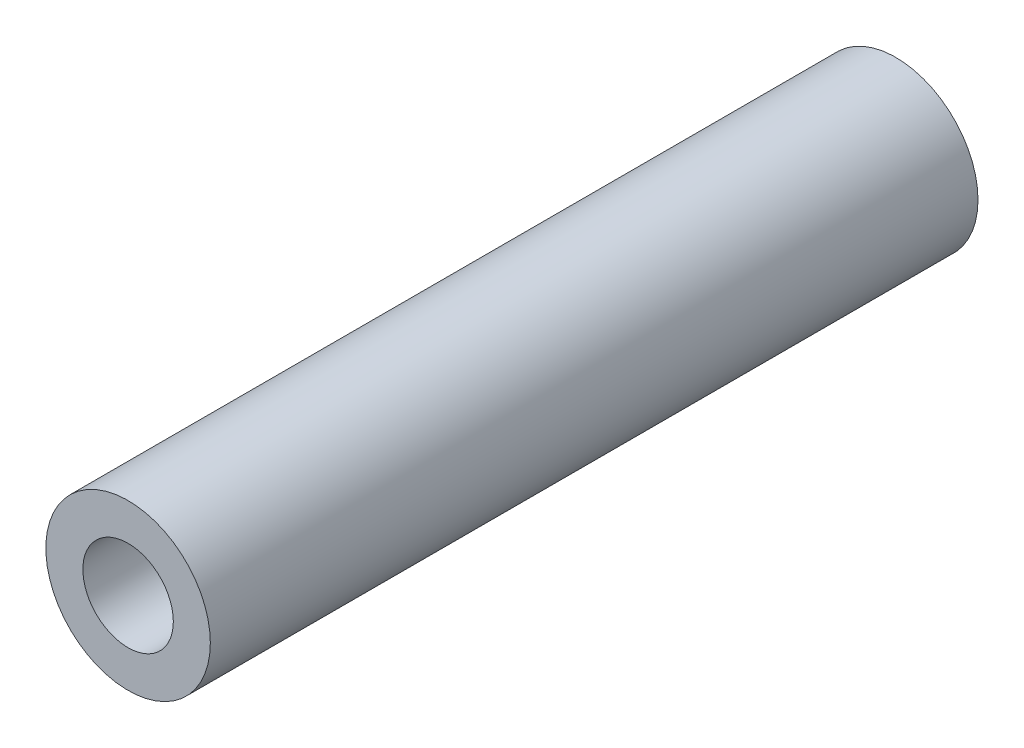
from build123d import *

# Parameters (mm, degrees)
SZKIC1_W = 140
SZKIC1_H = 15
SZKIC2_W = 140
SZKIC2_H = 8.25


with BuildPart() as part:
    # Szkic1 → Obrót1 (revolve)
    with BuildSketch(Plane(origin=(0, 0, 0), x_dir=(0, 0, -1), z_dir=(1, 0, 0))):
        with Locations((-70, 7.5)):
            Rectangle(SZKIC1_W, SZKIC1_H)
    revolve(axis=Axis((0, 0, 0), (0, 0, 1)))

    # Szkic2 → Wycięcie-obrót1 (revolve, cut)
    with BuildSketch(Plane(origin=(0, 0, 0), x_dir=(0, 0, -1), z_dir=(1, 0, 0))):
        with Locations((-70, 4.125)):
            Rectangle(SZKIC2_W, SZKIC2_H)
    revolve(axis=Axis((0, 0, 0), (0, 0, 1)), mode=Mode.SUBTRACT)


solid = part.part
